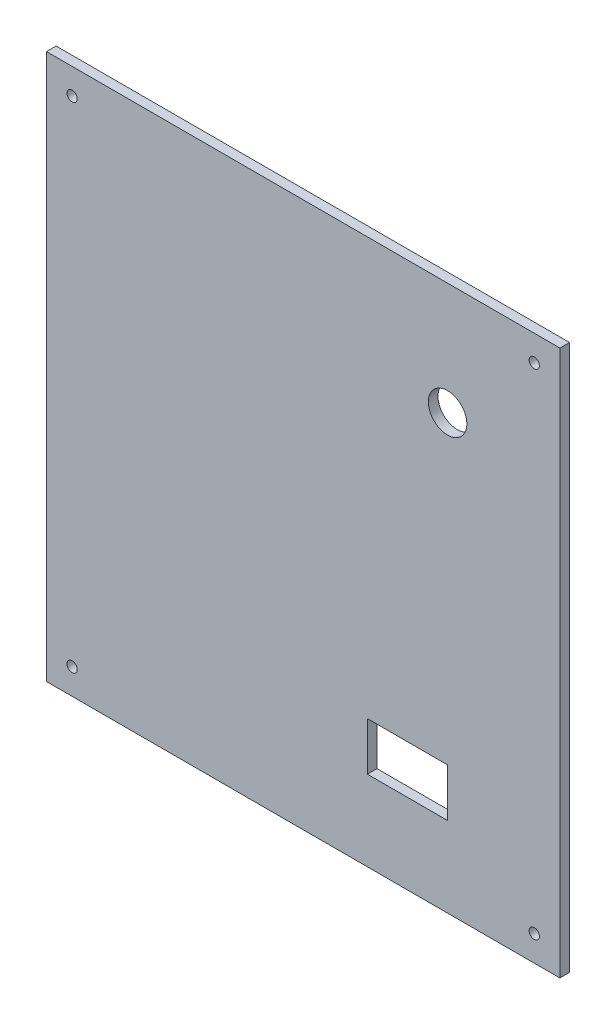
from build123d import *

# Parameters (mm, degrees)
SKETCH_1_W          = 160
SKETCH_1_H          = 170
EXTRUDE_1_DEPTH     = 3
SKETCH_2_R          = 1.6
CUT_EXTRUDE_1_DEPTH = 13
SKETCH_3_R          = 6
CUT_EXTRUDE_2_DEPTH = 13
SKETCH_4_W          = 25
SKETCH_4_H          = 15
CUT_EXTRUDE_3_DEPTH = 13


with BuildPart() as part:
    # 草图1 → 凸台-拉伸1 (new body)
    with BuildSketch(Plane.XY):
        with Locations((35.416666667, -46.25)):
            Rectangle(SKETCH_1_W, SKETCH_1_H)
    extrude(amount=EXTRUDE_1_DEPTH)

    # 草图2 → 切除-拉伸1 (cut)
    with BuildSketch(Plane.XY.offset(3)):
        with Locations((-36.583333333, 30.75)):
            Circle(SKETCH_2_R)
        with Locations((107.416666667, 30.75)):
            Circle(SKETCH_2_R)
        with Locations((107.416666667, -123.25)):
            Circle(SKETCH_2_R)
        with Locations((-36.583333333, -123.25)):
            Circle(SKETCH_2_R)
    extrude(amount=-CUT_EXTRUDE_1_DEPTH, mode=Mode.SUBTRACT)

    # 草图3 → 切除-拉伸2 (cut)
    with BuildSketch(Plane.XY.offset(3)):
        with Locations((80.416666667, 3.75)):
            Circle(SKETCH_3_R)
    extrude(amount=-CUT_EXTRUDE_2_DEPTH, mode=Mode.SUBTRACT)

    # 草图4 → 切除-拉伸3 (cut)
    with BuildSketch(Plane.XY.offset(3)):
        with Locations((67.916666667, -98.75)):
            Rectangle(SKETCH_4_W, SKETCH_4_H)
    extrude(amount=-CUT_EXTRUDE_3_DEPTH, mode=Mode.SUBTRACT)


solid = part.part
